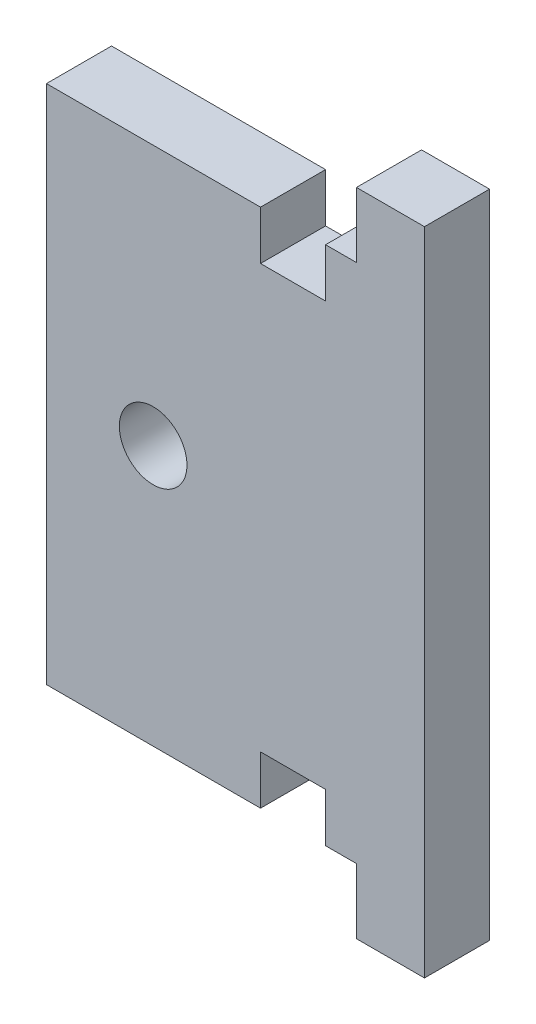
from build123d import *

# Parameters (mm, degrees)
SKETCH2_W               = 43.942
SKETCH2_H               = 127
BOSS_EXTRUDE1_DEPTH     = 6.35
M6_CLEARANCE_HOLE1_D    = 6.6
CUT_EXTRUDE1_DEPTH      = 135.537065019
CUT_EXTRUDE1_DEPTH_BACK = 135.537065019
SKETCH5_W               = 7.0505
SKETCH5_H               = 127
SKETCH6_W               = 27.8745
SKETCH6_H               = 3.175
CUT_EXTRUDE2_DEPTH      = 135.537065019
SKETCH7_W               = 6.35
SKETCH7_H               = 4.7625
CUT_EXTRUDE3_DEPTH      = 135.537065019
CUT_EXTRUDE4_DEPTH      = 135.537065019
CUT_EXTRUDE4_DEPTH_BACK = 135.537065019
SKETCH8_R               = 3.3


with BuildPart() as part:
    # Sketch2 → Boss-Extrude1 (new body)
    with BuildSketch(Plane.XY):
        with Locations((21.971, 63.5)):
            Rectangle(SKETCH2_W, SKETCH2_H)
    extrude(amount=BOSS_EXTRUDE1_DEPTH)

    # M6 Clearance Hole1 (through all)
    with Locations(Plane.XY.offset(6.35)):
        with Locations((17.4625, 31.75), (17.4625, 95.25)):
            Hole(M6_CLEARANCE_HOLE1_D / 2)

    # Sketch5 → Cut-Extrude1 (cut, two sides: drawn at the far end of the back side and taken through both)
    with BuildSketch(Plane.XY.offset(6.35).offset(-CUT_EXTRUDE1_DEPTH_BACK)):
        with Locations((3.52525, 63.5)):
            Rectangle(SKETCH5_W, SKETCH5_H)
    extrude(amount=CUT_EXTRUDE1_DEPTH + CUT_EXTRUDE1_DEPTH_BACK, mode=Mode.SUBTRACT)

    # Sketch6 → Cut-Extrude2 (cut, through all)
    with BuildSketch(Plane.XY.offset(6.35)):
        Polygon((7.0505, 123.825), (7.0505, 120.65), (37.30625, 120.65), (37.30625, 127), (34.925, 127), (34.925, 123.825), align=None)
        with Locations((20.98775, 125.4125)):
            Rectangle(SKETCH6_W, SKETCH6_H)
        Polygon((37.30625, 66.675), (7.0505, 66.675), (7.0505, 63.5), (34.925, 63.5), (34.925, 60.325), (7.0505, 60.325), (7.0505, 57.15), (37.30625, 57.15), align=None)
        with Locations((20.98775, 61.9125)):
            Rectangle(SKETCH6_W, SKETCH6_H)
        Polygon((37.30625, 0), (37.30625, 6.35), (7.0505, 6.35), (7.0505, 3.175), (34.925, 3.175), (34.925, 0), align=None)
        with Locations((20.98775, 1.5875)):
            Rectangle(SKETCH6_W, SKETCH6_H)
    extrude(amount=-CUT_EXTRUDE2_DEPTH, mode=Mode.SUBTRACT)

    # Sketch7 → Cut-Extrude3 (cut, through all)
    with BuildSketch(Plane.XY.offset(6.35)):
        with Locations((31.115, 118.26875)):
            Rectangle(SKETCH7_W, SKETCH7_H)
        with Locations((31.115, 69.05625)):
            Rectangle(SKETCH7_W, SKETCH7_H)
        with Locations((31.115, 54.76875)):
            Rectangle(SKETCH7_W, SKETCH7_H)
        with Locations((31.115, 8.73125)):
            Rectangle(SKETCH7_W, SKETCH7_H)
    extrude(amount=-CUT_EXTRUDE3_DEPTH, mode=Mode.SUBTRACT)

    # Sketch8 → Cut-Extrude4 (cut, two sides: drawn at the far end of the back side and taken through both)
    with BuildSketch(Plane.XY.offset(6.35).offset(-CUT_EXTRUDE4_DEPTH_BACK)):
        Polygon((37.30625, 66.675), (37.30625, 63.5), (43.942, 63.5), (43.942, 127), (37.30625, 127), (37.30625, 120.65), (34.29, 120.65), (34.29, 115.8875), (27.94, 115.8875), (27.94, 120.65), (7.0505, 120.65), (7.0505, 66.675), (27.94, 66.675), (27.94, 71.4375), (34.29, 71.4375), (34.29, 66.675), align=None)
        with Locations((17.4625, 95.25)):
            Circle(SKETCH8_R, mode=Mode.SUBTRACT)
    extrude(amount=CUT_EXTRUDE4_DEPTH + CUT_EXTRUDE4_DEPTH_BACK, mode=Mode.SUBTRACT)


solid = part.part
